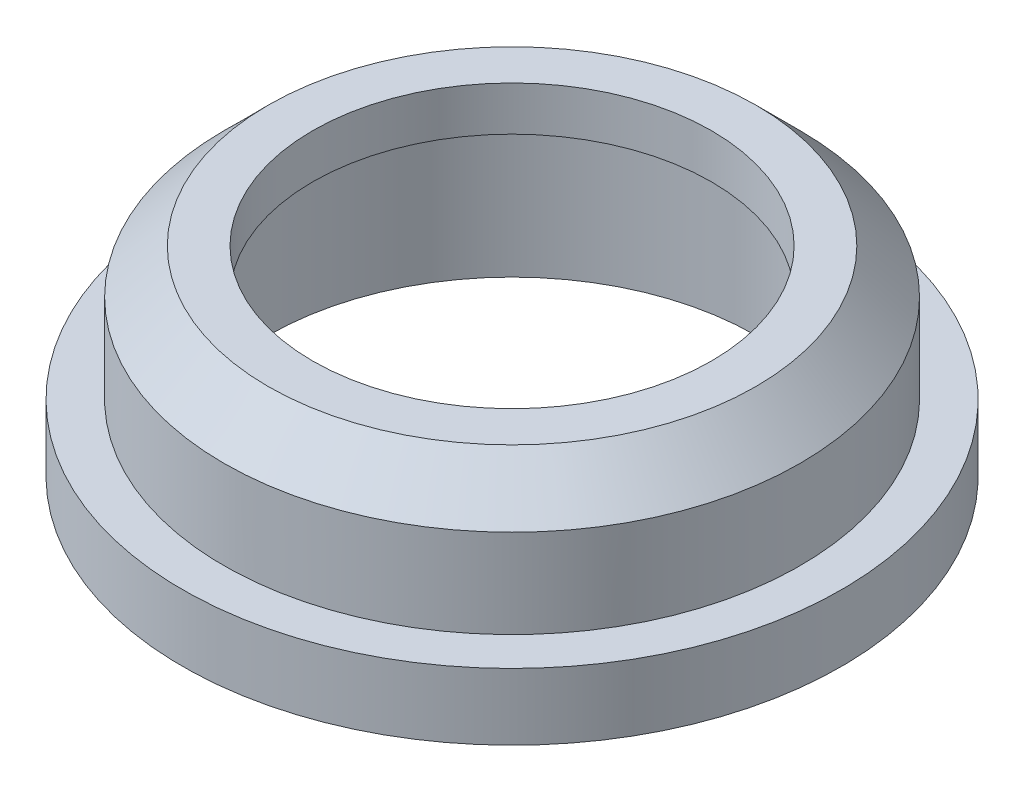
from build123d import *

# Parameters (mm, degrees)
CROQUIS1_R                 = 11
CROQUIS1_R_2               = 2
CROQUIS1_W                 = 30
CROQUIS1_H                 = 3
SALIENTE_EXTRUIR1_DEPTH    = 3
CROQUIS2_R                 = 13
CROQUIS2_R_2               = 11
SALIENTE_EXTRUIR2_DEPTH    = 4
CROQUIS3_R                 = 13
CROQUIS3_R_2               = 9
SALIENTE_EXTRUIR3_DEPTH    = 2
CHAFL_N1_SIZE              = 2
CHAFL_N2_SIZE              = 10
CORTAR_EXTRUIR1_DEPTH      = 10
CORTAR_EXTRUIR1_DEPTH_BACK = 10
CROQUIS4_OUTSIDE_W         = 165.218
CROQUIS4_OUTSIDE_H         = 70.218
CROQUIS4_OUTSIDE_R         = 14.870057098


with BuildPart() as part:
    # Croquis1 → Saliente-Extruir1 (new body)
    with BuildSketch(Plane(origin=(0, 0, 0), x_dir=(1, 0, 0), z_dir=(0, 1, 0))):
        Polygon((65, 10), (70, 15), (70, -15), (65, -10), (65, -20), (-65, -20), (-65, 20), (65, 20), align=None)
        with Locations(Location((-50.129942902, 0, 0), (0, 0, 270))):
            Circle(CROQUIS1_R, mode=Mode.SUBTRACT)
        with Locations(Location((-28.595127909, 0, 0), (0, 0, 270))):
            Circle(CROQUIS1_R_2, mode=Mode.SUBTRACT)
        with Locations(Location((-13.595127909, 0, 0), (0, 0, 270))):
            Circle(CROQUIS1_R_2, mode=Mode.SUBTRACT)
        with Locations(Location((50, 0, 0), (0, 0, 270))):
            Circle(CROQUIS1_R_2, mode=Mode.SUBTRACT)
        with Locations((25, 11)):
            Rectangle(CROQUIS1_W, CROQUIS1_H, mode=Mode.SUBTRACT)
        with Locations((25, -11)):
            Rectangle(CROQUIS1_W, CROQUIS1_H, mode=Mode.SUBTRACT)
    extrude(amount=SALIENTE_EXTRUIR1_DEPTH)

    # Croquis2 → Saliente-Extruir2 (add)
    with BuildSketch(Plane(origin=(0, 3, 0), x_dir=(1, 0, 0), z_dir=(0, 1, 0))):
        with Locations(Location((-50.129942902, 0, 0), (0, 0, 90))):
            Circle(CROQUIS2_R)
        with Locations(Location((-50.129942902, 0, 0), (0, 0, 270))):
            Circle(CROQUIS2_R_2, mode=Mode.SUBTRACT)
    extrude(amount=SALIENTE_EXTRUIR2_DEPTH)

    # Croquis3 → Saliente-Extruir3 (add)
    with BuildSketch(Plane(origin=(0, 7, 0), x_dir=(1, 0, 0), z_dir=(0, 1, 0))):
        with Locations(Location((-50.129942902, 0, 0), (0, 0, 90))):
            Circle(CROQUIS3_R)
        with Locations(Location((-50.129942902, 0, 0), (0, 0, 270))):
            Circle(CROQUIS3_R_2, mode=Mode.SUBTRACT)
    extrude(amount=SALIENTE_EXTRUIR3_DEPTH)

    # Chaflán1
    chafl_n1_edges = [part.edges().sort_by_distance(p)[0] for p in [
        (-50.129942902, 9, 13),
    ]]
    chamfer(chafl_n1_edges, length=CHAFL_N1_SIZE)

    # Chaflán2
    chafl_n2_edges = [part.edges().sort_by_distance(p)[0] for p in [
        (-65, 1.5, 20),
        (-65, 1.5, -20),
    ]]
    chamfer(chafl_n2_edges, length=CHAFL_N2_SIZE)

    # Croquis4 outside → Cortar-Extruir1 (cut, two sides: drawn at the far end of the back side and taken through both)
    with BuildSketch(Plane(origin=(0, 3, 0), x_dir=(1, 0, 0), z_dir=(0, 1, 0)).offset(-CORTAR_EXTRUIR1_DEPTH_BACK)):
        with Locations((2.5, 0)):
            Rectangle(CROQUIS4_OUTSIDE_W, CROQUIS4_OUTSIDE_H)
        with Locations(Location((-50.129942902, 0, 0), (0, 0, 90))):
            Circle(CROQUIS4_OUTSIDE_R, mode=Mode.SUBTRACT)
    extrude(amount=CORTAR_EXTRUIR1_DEPTH + CORTAR_EXTRUIR1_DEPTH_BACK, mode=Mode.SUBTRACT)


solid = part.part
